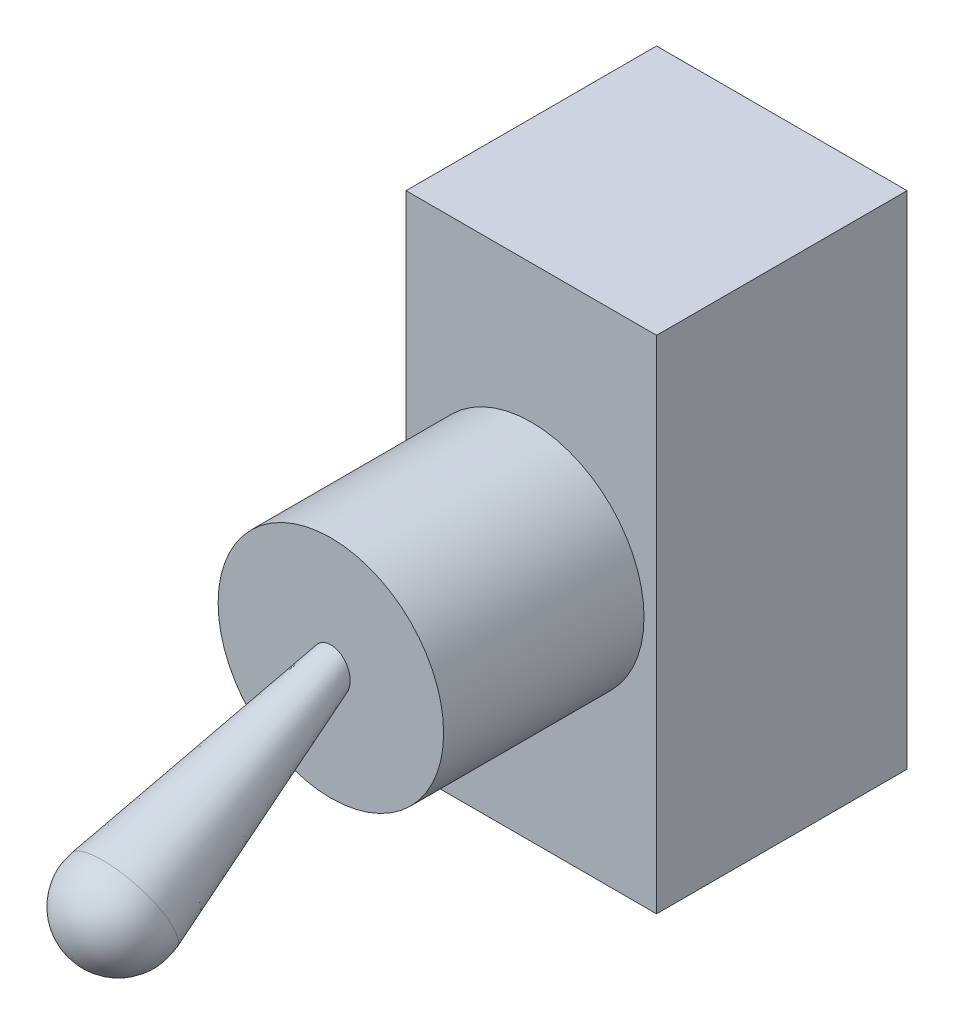
from build123d import *

# Parameters (mm, degrees)
SKETCH1_W      = 12.7
SKETCH1_H      = 25.4
EXTRUDE1_DEPTH = 12.7
SKETCH1_3_R    = 5.715
EXTRUDE2_DEPTH = 10.16
FILLET1_R      = 2.54


with BuildPart() as part:
    # Sketch1 → Extrude1 (new body)
    with BuildSketch(Plane.XY):
        Rectangle(SKETCH1_W, SKETCH1_H)
    extrude(amount=-EXTRUDE1_DEPTH)

    # Sketch1<3> → Extrude2 (add)
    with BuildSketch(Plane.XY):
        Circle(SKETCH1_3_R)
    extrude(amount=EXTRUDE2_DEPTH)

    # Sketch2 → Revolve1 (revolve)
    with BuildSketch(Plane(origin=(0, 0, 0), x_dir=(0, 0, -1), z_dir=(1, 0, 0))):
        Polygon((-10.16, 1.016088838), (-24.491517392, -3.538898285), (-23.243143226, -6.1812071), (-10.16, 0), align=None)
    revolve(axis=Axis((0, 0, 10.16), (0, -0.4271789944976144, 0.9041670789516765)))

    # Fillet1
    fillet1_edges = [part.edges().sort_by_distance(p)[0] for p in [
        (0, -8.823515916, 21.99476906),
    ]]
    fillet(fillet1_edges, radius=FILLET1_R)


solid = part.part
